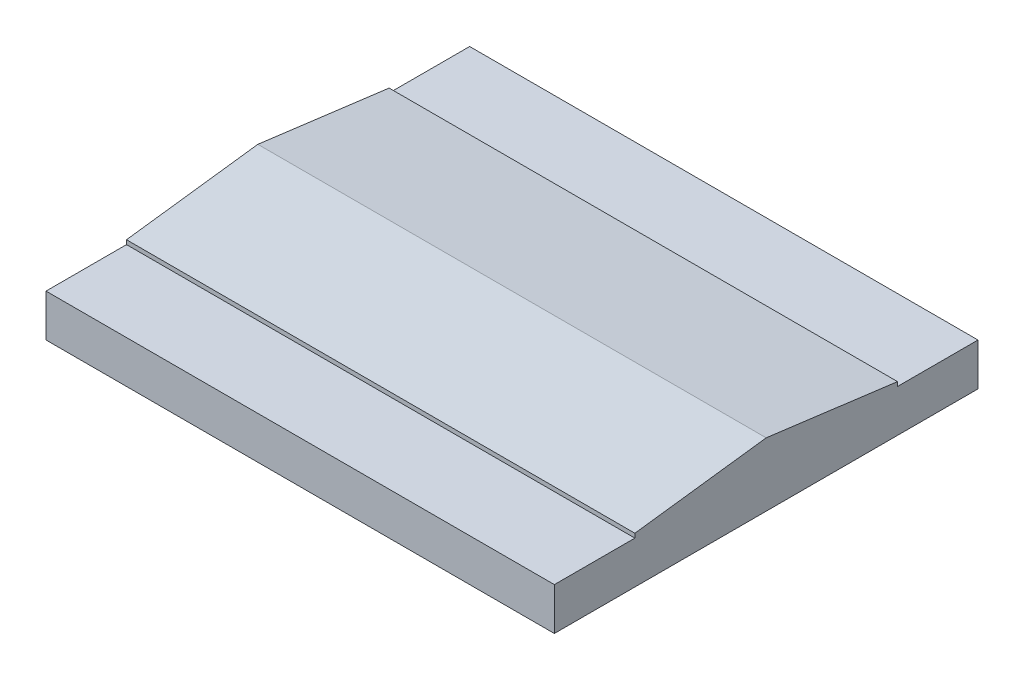
from build123d import *

# Parameters (mm, degrees)
SKETCH_1_W          = 600
SKETCH_1_H          = 500
EXTRUDE_1_DEPTH     = 75
CUT_EXTRUDE_1_DEPTH = 785.617741324
CUT_EXTRUDE_2_DEPTH = 785.617741324


with BuildPart() as part:
    # 草图1 → 凸台-拉伸1 (new body)
    with BuildSketch(Plane(origin=(0, 0, 0), x_dir=(1, 0, 0), z_dir=(0, 1, 0))):
        with Locations((300, 250)):
            Rectangle(SKETCH_1_W, SKETCH_1_H)
    extrude(amount=EXTRUDE_1_DEPTH)

    # 草图3 → 切除-拉伸1 (cut, through all)
    with BuildSketch(Plane(origin=(600, 0, 0), x_dir=(0, 0, -1), z_dir=(1, 0, 0))):
        Polygon((405, 55), (405, 50), (500, 50), (500, 75), (250, 75), align=None)
    extrude(amount=-CUT_EXTRUDE_1_DEPTH, mode=Mode.SUBTRACT)

    # 草图4 → 切除-拉伸2 (cut, through all)
    with BuildSketch(Plane(origin=(600, 0, 0), x_dir=(0, 0, -1), z_dir=(1, 0, 0))):
        Polygon((0, 75), (0, 50), (95, 50), (95, 55), (250, 75), align=None)
    extrude(amount=-CUT_EXTRUDE_2_DEPTH, mode=Mode.SUBTRACT)


solid = part.part
